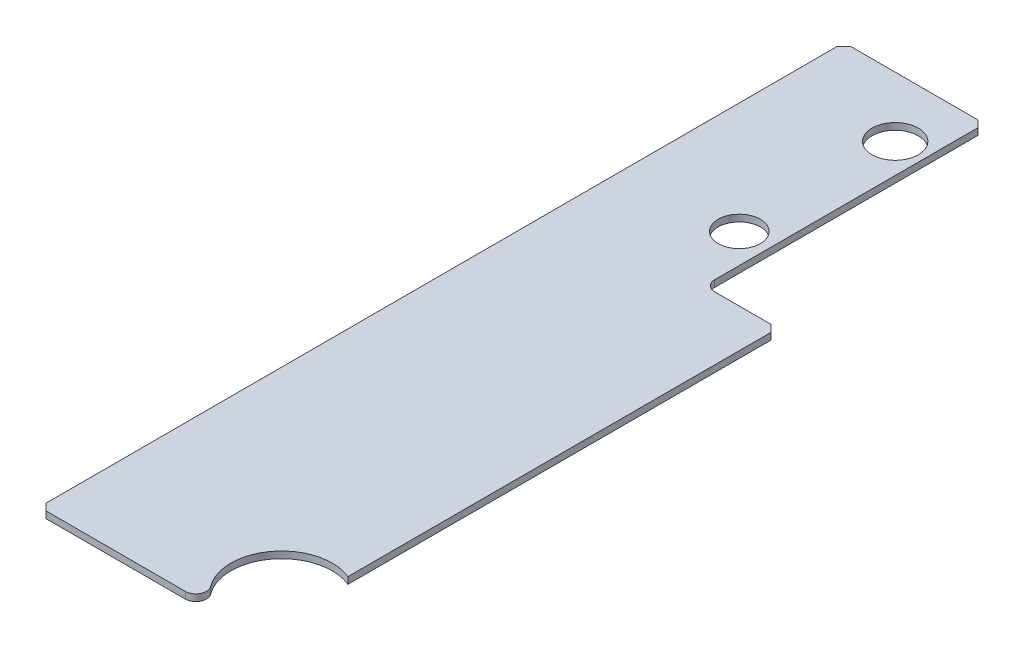
from build123d import *

# Parameters (mm, degrees)
SKETCH1_W           = 101.6
SKETCH1_H           = 381
BOSS_EXTRUDE1_DEPTH = 3.175
CHAMFER1_SIZE       = 3.175
CUT_EXTRUDE1_REACH  = 199.183
SKETCH2_R           = 23.981466634
SKETCH2_R_2         = 10.952088468
SKETCH2_R_3         = 9.996566117
SKETCH2_W           = 34.925
SKETCH2_H           = 132.842153018
CHAMFER2_SIZE       = 3.175
FILLET1_R           = 5
FILLET2_R           = 5


with BuildPart() as part:
    # Sketch1 → Boss-Extrude1 (new body)
    with BuildSketch(Plane(origin=(0, 0, 0), x_dir=(1, 0, 0), z_dir=(0, 1, 0))):
        Rectangle(SKETCH1_W, SKETCH1_H)
    extrude(amount=BOSS_EXTRUDE1_DEPTH)

    # Chamfer1
    chamfer1_edges = [part.edges().sort_by_distance(p)[0] for p in [
        (-50.8, 1.5875, -190.5),
        (50.8, 1.5875, -190.5),
        (50.8, 1.5875, 190.5),
        (-50.8, 1.5875, 190.5),
    ]]
    chamfer(chamfer1_edges, length=CHAMFER1_SIZE)

    # Sketch2 → Cut-Extrude1 (cut, up to next)
    with BuildSketch(Plane(origin=(0, 3.175, 0), x_dir=(1, 0, 0), z_dir=(0, 1, 0)), mode=Mode.PRIVATE) as cut_extrude1_sk1:
        with Locations((41.515832085, -168.095479014)):
            Circle(SKETCH2_R)
    cut_extrude1_tool1 = extrude(cut_extrude1_sk1.sketch, amount=-CUT_EXTRUDE1_REACH, mode=Mode.PRIVATE) & part.part
    # Sketch2 → Cut-Extrude1 (cut, up to next)
    with BuildSketch(Plane(origin=(0, 3.175, 0), x_dir=(1, 0, 0), z_dir=(0, 1, 0)), mode=Mode.PRIVATE) as cut_extrude1_sk2:
        with Locations((1.89865, 162.0774)):
            Circle(SKETCH2_R_2)
    cut_extrude1_tool2 = extrude(cut_extrude1_sk2.sketch, amount=-CUT_EXTRUDE1_REACH, mode=Mode.PRIVATE) & part.part
    # Sketch2 → Cut-Extrude1 (cut, up to next)
    with BuildSketch(Plane(origin=(0, 3.175, 0), x_dir=(1, 0, 0), z_dir=(0, 1, 0)), mode=Mode.PRIVATE) as cut_extrude1_sk3:
        with Locations((1.89865, 88.265)):
            Circle(SKETCH2_R_3)
    cut_extrude1_tool3 = extrude(cut_extrude1_sk3.sketch, amount=-CUT_EXTRUDE1_REACH, mode=Mode.PRIVATE) & part.part
    # Sketch2 → Cut-Extrude1 (cut, up to next)
    with BuildSketch(Plane(origin=(0, 3.175, 0), x_dir=(1, 0, 0), z_dir=(0, 1, 0)), mode=Mode.PRIVATE) as cut_extrude1_sk4:
        with Locations((33.3375, 124.078923491)):
            Rectangle(SKETCH2_W, SKETCH2_H)
    cut_extrude1_tool4 = extrude(cut_extrude1_sk4.sketch, amount=-CUT_EXTRUDE1_REACH, mode=Mode.PRIVATE) & part.part
    add(cut_extrude1_tool1.solids().sort_by_distance((41.515832, 3.175, 168.095479))[0], mode=Mode.SUBTRACT)
    add(cut_extrude1_tool2.solids().sort_by_distance((1.89865, 3.175, -162.0774))[0], mode=Mode.SUBTRACT)
    add(cut_extrude1_tool3.solids().sort_by_distance((1.89865, 3.175, -88.265))[0], mode=Mode.SUBTRACT)
    add(cut_extrude1_tool4.solids().sort_by_distance((33.3375, 3.175, -124.078923))[0], mode=Mode.SUBTRACT)

    # Chamfer2
    chamfer2_edges = [part.edges().sort_by_distance(p)[0] for p in [
        (50.8, 1.5875, -57.657846982),
        (15.875, 1.5875, -190.5),
    ]]
    chamfer(chamfer2_edges, length=CHAMFER2_SIZE)

    # Fillet1
    fillet1_edges = [part.edges().sort_by_distance(p)[0] for p in [
        (15.875, 1.5875, -57.657846982),
    ]]
    fillet(fillet1_edges, radius=FILLET1_R)

    # Fillet2
    fillet2_edges = [part.edges().sort_by_distance(p)[0] for p in [
        (32.963161081, 1.5875, 190.5),
    ]]
    fillet(fillet2_edges, radius=FILLET2_R)


solid = part.part
